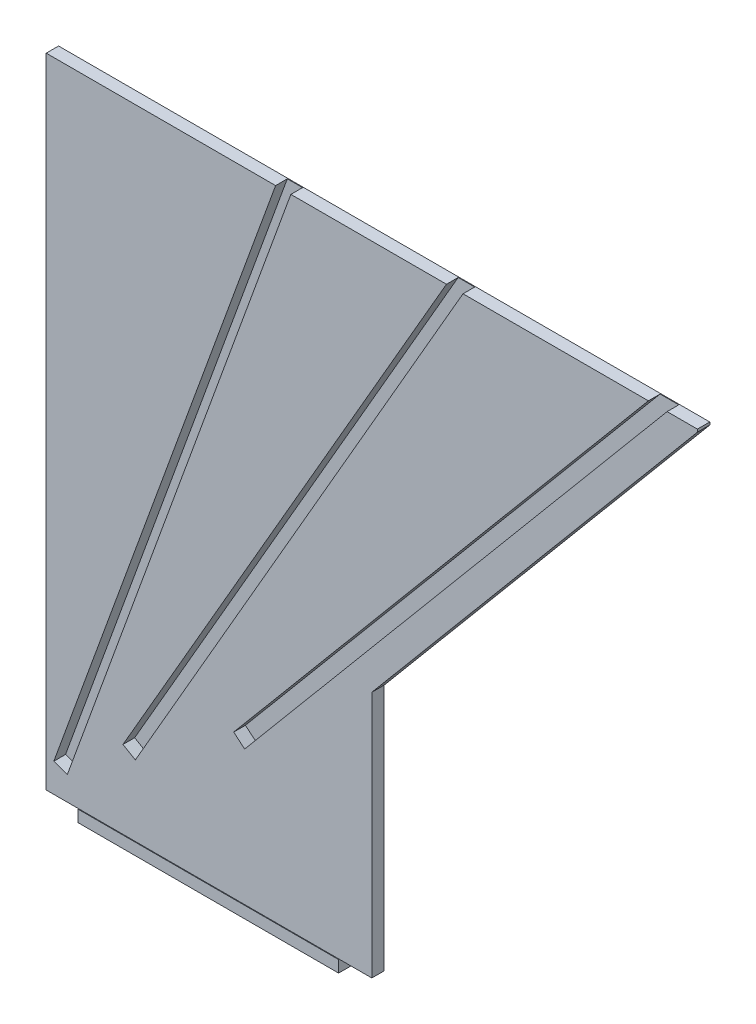
from build123d import *

# Parameters (mm, degrees)
BOSS_EXTRUDE1_DEPTH = 1.9
BOSS_EXTRUDE5_DEPTH = 0.1
SKETCH6_W           = 40
SKETCH6_H           = 2
BOSS_EXTRUDE6_DEPTH = 0.1
CHAMFER2_SIZE       = 0.2


with BuildPart() as part:
    # Sketch1 → Boss-Extrude1 (new body)
    with BuildSketch(Plane.XY):
        Polygon((-36.312345137, -37.152540378), (-38.217601025, -36.052540378), (11.464856327, 50), (-12.432381024, 50), (-46.771329023, -44.345484236), (-48.838652789, -43.593039921), (-14.773572123, 50), (-50, 50), (-50, -48), (-45, -48), (-45, -50), (-5, -50), (-5, -48), (0, -48), (0, -10), (50, 49.58767963), (50, 50), (45.345911136, 50), (-19.526148963, -27.311510683), (-21.211446738, -25.897377941), (42.474015099, 50), (14.005197511, 50), align=None)
    extrude(amount=BOSS_EXTRUDE1_DEPTH)

    # Sketch2 → Boss-Extrude5 (add)
    with BuildSketch(Plane(origin=(0, 0, 0), x_dir=(-1, 0, 0), z_dir=(0, 0, -1))):
        Polygon((-45.345911136, 50), (-42.474015099, 50), (21.211446738, -25.897377941), (19.526148963, -27.311510683), align=None)
        Polygon((-14.005197511, 50), (36.312345137, -37.152540378), (38.217601025, -36.052540378), (-11.464856327, 50), align=None)
        Polygon((12.432381024, 50), (14.773572123, 50), (48.838652789, -43.593039921), (46.771329023, -44.345484236), align=None)
    extrude(amount=-BOSS_EXTRUDE5_DEPTH)

    # Sketch6 → Boss-Extrude6 (add)
    with BuildSketch(Plane.XY.offset(1.9)):
        with Locations((-25, -49)):
            Rectangle(SKETCH6_W, SKETCH6_H)
    extrude(amount=BOSS_EXTRUDE6_DEPTH)

    # Chamfer2
    chamfer2_edges = [part.edges().sort_by_distance(p)[0] for p in [
        (-25, -50, 2),
        (-25, -50, 0),
        (-5, -50, 1),
        (-45, -50, 1),
    ]]
    chamfer(chamfer2_edges, length=CHAMFER2_SIZE)


solid = part.part
